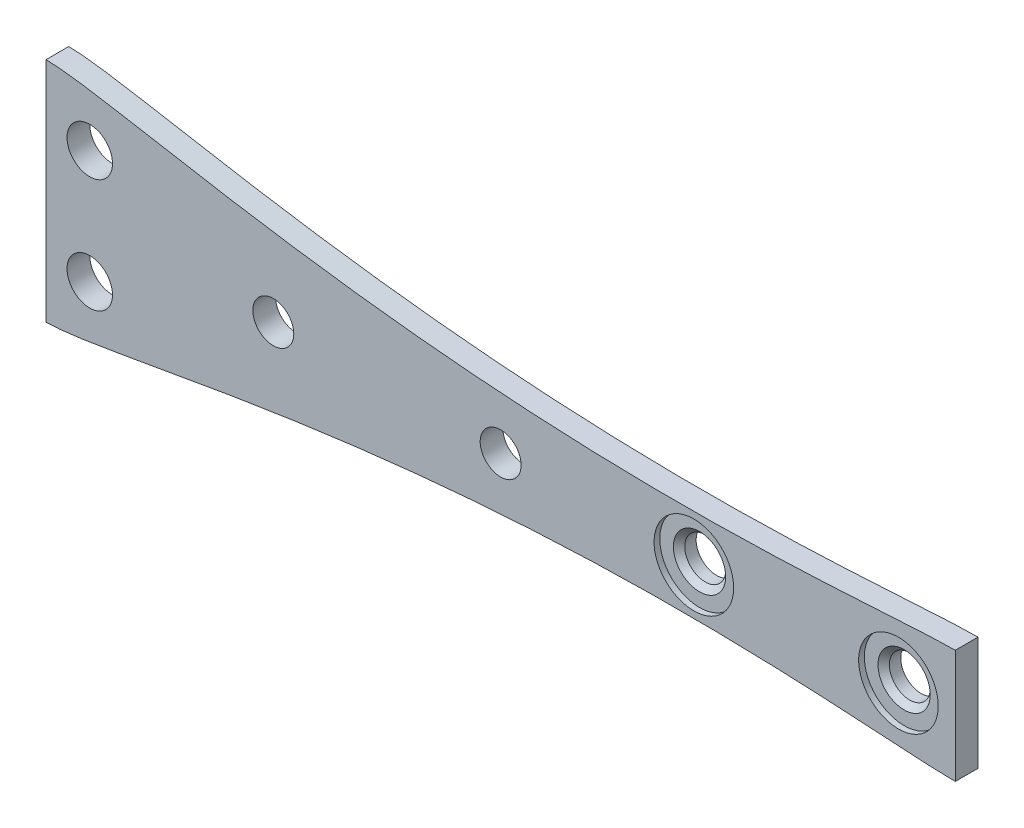
from build123d import *

# Parameters (mm, degrees)
ESQUISSE1_R             = 2
ESQUISSE1_R_2           = 1.8
BOSS_EXTRU_1_DEPTH      = 2
ESQUISSE3_R             = 3.5
ENL_V_MAT_EXTRU_1_DEPTH = 0.5
CHANFREIN1_SIZE         = 0.5


with BuildPart() as part:
    # Esquisse1 → Boss.-Extru.1 (new body)
    with BuildSketch(Plane.XY):
        with BuildLine():
            Line((0, 0), (0, 20))
            add(Edge.make_bspline(
                [(0, 20), (8, 20), (39, 10), (70, 15), (80, 15)],
                knots=[0, 0, 0, 0, 0, 1, 1, 1, 1, 1], degree=4))
            Line((80, 15), (80, 5))
            add(Edge.make_bspline(
                [(0, 0), (8, 0), (39, 10), (70, 5), (80, 5)],
                knots=[0, 0, 0, 0, 0, 1, 1, 1, 1, 1], degree=4))
        make_face()
        with Locations((3.85, 15)):
            Circle(ESQUISSE1_R, mode=Mode.SUBTRACT)
        with Locations((3.85, 5)):
            Circle(ESQUISSE1_R, mode=Mode.SUBTRACT)
        with Locations((57, 10)):
            Circle(ESQUISSE1_R_2, mode=Mode.SUBTRACT)
        with Locations((75, 10)):
            Circle(ESQUISSE1_R_2, mode=Mode.SUBTRACT)
        with Locations((20, 10)):
            Circle(ESQUISSE1_R_2, mode=Mode.SUBTRACT)
        with Locations((40, 10)):
            Circle(ESQUISSE1_R_2, mode=Mode.SUBTRACT)
    extrude(amount=BOSS_EXTRU_1_DEPTH)

    # Esquisse3 → Enlèv. mat.-Extru.1 (cut)
    with BuildSketch(Plane.XY.offset(2)):
        with Locations((57, 10)):
            Circle(ESQUISSE3_R)
        with Locations((75, 10)):
            Circle(ESQUISSE3_R)
    extrude(amount=-ENL_V_MAT_EXTRU_1_DEPTH, mode=Mode.SUBTRACT)

    # Chanfrein1
    chanfrein1_edges = [part.edges().sort_by_distance(p)[0] for p in [
        (55.2, 10, 1.5),
        (73.2, 10, 1.5),
    ]]
    chamfer(chanfrein1_edges, length=CHANFREIN1_SIZE)


solid = part.part
